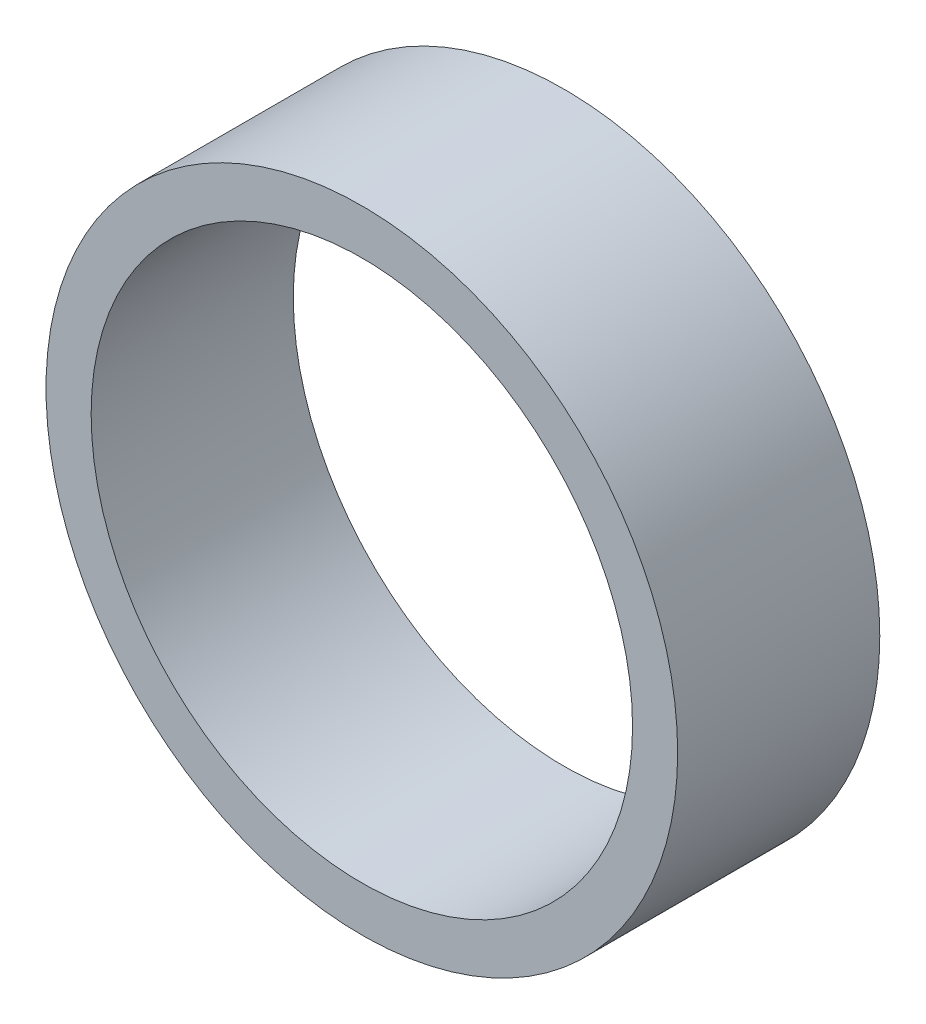
from build123d import *

# Parameters (mm, degrees)
SKETCH1_R           = 11.1125
SKETCH1_R_2         = 9.525
BOSS_EXTRUDE1_DEPTH = 7.112


with BuildPart() as part:
    # Sketch1 → Boss-Extrude1 (new body)
    with BuildSketch(Plane.XY):
        Circle(SKETCH1_R)
        Circle(SKETCH1_R_2, mode=Mode.SUBTRACT)
    extrude(amount=BOSS_EXTRUDE1_DEPTH)


solid = part.part
